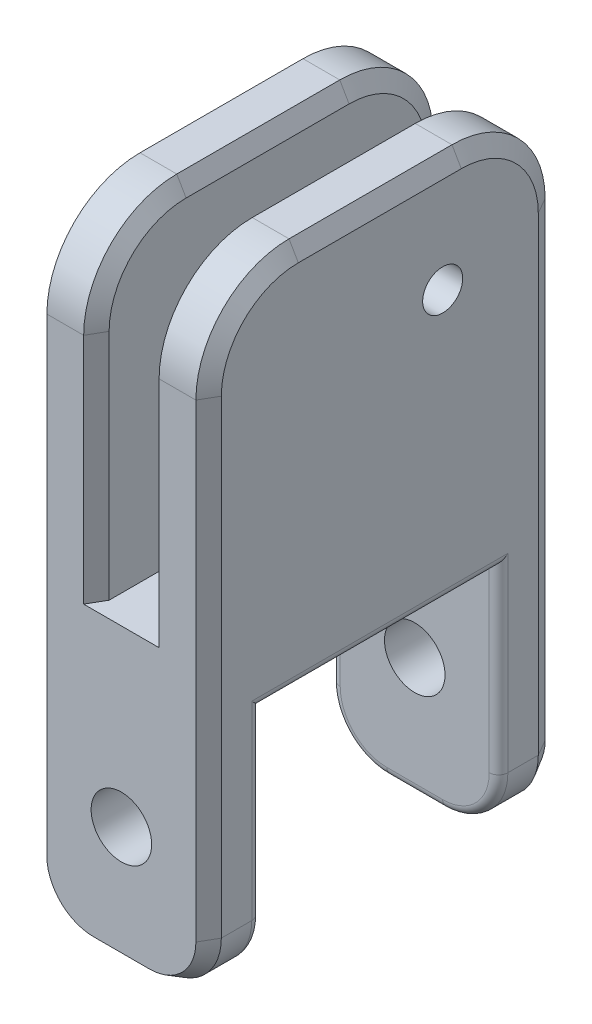
from build123d import *
from OCP.BRepFilletAPI import BRepFilletAPI_MakeChamfer

# Parameters (mm, degrees)
SKETCH1_W           = 18
SKETCH1_H           = 25.4
SKETCH1_R           = 3.25
BOSS_EXTRUDE1_DEPTH = 6
SKETCH2_W           = 18
SKETCH2_H           = 37.5
BOSS_EXTRUDE2_DEPTH = 6
SKETCH3_W           = 5.95
SKETCH3_H           = 37.5
BOSS_EXTRUDE3_DEPTH = 35
SKETCH4_R           = 2.15
CUT_EXTRUDE1_DEPTH  = 65.806944072
CUT_EXTRUDE2_REACH  = 66.807
SKETCH5_R           = 2.95
FILLET1_R           = 10
FILLET2_R           = 6
CHAMFER1_SIZE       = 1
CHAMFER1_SIZE2      = 1.732050808
CHAMFER2_SIZE       = 1
CHAMFER2_SIZE2      = 1.732050808
FILLET3_R           = 1


with BuildPart() as part:
    # Sketch1 → Boss-Extrude1 (new body)
    with BuildSketch(Plane.XY):
        Rectangle(SKETCH1_W, SKETCH1_H)
        Circle(SKETCH1_R, mode=Mode.SUBTRACT)
    boss_extrude1 = extrude(amount=BOSS_EXTRUDE1_DEPTH)

    # Sketch2 → Boss-Extrude2 (add)
    with BuildSketch(Plane(origin=(0, 12.7, 0), x_dir=(1, 0, 0), z_dir=(0, 1, 0))):
        with Locations((0, 12.75)):
            Rectangle(SKETCH2_W, SKETCH2_H)
    extrude(amount=BOSS_EXTRUDE2_DEPTH)

    # Mirror1: Boss-Extrude1 across plane
    add(boss_extrude1.mirror(Plane.XY.offset(-12.75)))

    # Sketch3 → Boss-Extrude3 (add)
    with BuildSketch(Plane(origin=(0, 18.7, 0), x_dir=(1, 0, 0), z_dir=(0, 1, 0))):
        with Locations((6.025, 12.75)):
            Rectangle(SKETCH3_W, SKETCH3_H)
    boss_extrude3 = extrude(amount=BOSS_EXTRUDE3_DEPTH)

    # Mirror2: Boss-Extrude3 across plane
    add(boss_extrude3.mirror(Plane(origin=(0, 0, 0), x_dir=(0, 0, 1), z_dir=(1, 0, 0))))

    # Sketch4 → Cut-Extrude1 (cut, through all)
    with BuildSketch(Plane(origin=(9, 0, 0), x_dir=(0, 0, -1), z_dir=(1, 0, 0))):
        with Locations((19.5, 41.7)):
            Circle(SKETCH4_R)
    extrude(amount=-CUT_EXTRUDE1_DEPTH, mode=Mode.SUBTRACT)

    # Sketch5 → Cut-Extrude2 (cut, up to next)
    with BuildSketch(Plane.ZY.offset(9), mode=Mode.PRIVATE) as cut_extrude2_sk1:
        with Locations((-19.5, 41.7)):
            Circle(SKETCH5_R)
    cut_extrude2_tool1 = extrude(cut_extrude2_sk1.sketch, amount=-CUT_EXTRUDE2_REACH, mode=Mode.PRIVATE) & part.part
    add(cut_extrude2_tool1.solids().sort_by_distance((-9, 41.7, -19.5))[0], mode=Mode.SUBTRACT)

    # Fillet1
    fillet1_edges = [part.edges().sort_by_distance(p)[0] for p in [
        (6.025, 53.7, -31.5),
        (6.025, 53.7, 6),
        (-6.025, 53.7, 6),
        (-6.025, 53.7, -31.5),
    ]]
    fillet(fillet1_edges, radius=FILLET1_R)

    # Fillet2
    fillet2_edges = [part.edges().sort_by_distance(p)[0] for p in [
        (9, -12.7, -28.5),
        (-9, -12.7, -28.5),
        (9, -12.7, 3),
        (-9, -12.7, 3),
    ]]
    fillet(fillet2_edges, radius=FILLET2_R)

    # Chamfer1: one chamfer whose edges measure the first distance from different faces: ONE call of the kernel's chamfer builder (chamfer() names one face for all edges)
    chamfer1_edges_1 = [part.edges().sort_by_distance(p)[0] for p in [
        (-3.05, 31.2, -31.5),
        (3.05, 31.2, -31.5),
    ]]
    chamfer1_side_1 = [part.faces().sort_by_distance(p)[0] for p in [
        (0, 13.700522402, -31.5),
    ]]
    chamfer1_edges_2 = [part.edges().sort_by_distance(p)[0] for p in [
        (-3.05, 53.7, -12.75),
    ]]
    chamfer1_side_2 = [part.faces().sort_by_distance(p)[0] for p in [
        (-6.025, 53.7, -12.75),
    ]]
    chamfer1_edges_3 = [part.edges().sort_by_distance(p)[0] for p in [
        (-3.05, 31.2, 6),
        (3.05, 31.2, 6),
    ]]
    chamfer1_side_3 = [part.faces().sort_by_distance(p)[0] for p in [
        (0, 13.700522402, 6),
    ]]
    chamfer1_edges_4 = [part.edges().sort_by_distance(p)[0] for p in [
        (-3.05, 50.771067812, 3.071067812),
    ]]
    chamfer1_side_4 = [part.faces().sort_by_distance(p)[0] for p in [
        (-6.025, 50.771067812, 3.071067812),
    ]]
    chamfer1_edges_5 = [part.edges().sort_by_distance(p)[0] for p in [
        (-3.05, 50.771067812, -28.571067812),
    ]]
    chamfer1_side_5 = [part.faces().sort_by_distance(p)[0] for p in [
        (-6.025, 50.771067812, -28.571067812),
    ]]
    chamfer1_edges_6 = [part.edges().sort_by_distance(p)[0] for p in [
        (3.05, 53.7, -12.75),
    ]]
    chamfer1_side_6 = [part.faces().sort_by_distance(p)[0] for p in [
        (6.025, 53.7, -12.75),
    ]]
    chamfer1_edges_7 = [part.edges().sort_by_distance(p)[0] for p in [
        (3.05, 50.771067812, 3.071067812),
    ]]
    chamfer1_side_7 = [part.faces().sort_by_distance(p)[0] for p in [
        (6.025, 50.771067812, 3.071067812),
    ]]
    chamfer1_edges_8 = [part.edges().sort_by_distance(p)[0] for p in [
        (3.05, 50.771067812, -28.571067812),
    ]]
    chamfer1_side_8 = [part.faces().sort_by_distance(p)[0] for p in [
        (6.025, 50.771067812, -28.571067812),
    ]]
    chamfer1 = BRepFilletAPI_MakeChamfer(part.part.solid().wrapped)
    for e in chamfer1_edges_1:
        chamfer1.Add(CHAMFER1_SIZE, CHAMFER1_SIZE2, e.wrapped, chamfer1_side_1[0].wrapped)  # the first distance lies on this face
    for e in chamfer1_edges_2:
        chamfer1.Add(CHAMFER1_SIZE, CHAMFER1_SIZE2, e.wrapped, chamfer1_side_2[0].wrapped)  # the first distance lies on this face
    for e in chamfer1_edges_3:
        chamfer1.Add(CHAMFER1_SIZE, CHAMFER1_SIZE2, e.wrapped, chamfer1_side_3[0].wrapped)  # the first distance lies on this face
    for e in chamfer1_edges_4:
        chamfer1.Add(CHAMFER1_SIZE, CHAMFER1_SIZE2, e.wrapped, chamfer1_side_4[0].wrapped)  # the first distance lies on this face
    for e in chamfer1_edges_5:
        chamfer1.Add(CHAMFER1_SIZE, CHAMFER1_SIZE2, e.wrapped, chamfer1_side_5[0].wrapped)  # the first distance lies on this face
    for e in chamfer1_edges_6:
        chamfer1.Add(CHAMFER1_SIZE, CHAMFER1_SIZE2, e.wrapped, chamfer1_side_6[0].wrapped)  # the first distance lies on this face
    for e in chamfer1_edges_7:
        chamfer1.Add(CHAMFER1_SIZE, CHAMFER1_SIZE2, e.wrapped, chamfer1_side_7[0].wrapped)  # the first distance lies on this face
    for e in chamfer1_edges_8:
        chamfer1.Add(CHAMFER1_SIZE, CHAMFER1_SIZE2, e.wrapped, chamfer1_side_8[0].wrapped)  # the first distance lies on this face
    add(Compound.cast(chamfer1.Shape()), mode=Mode.REPLACE)

    # Chamfer2: one chamfer whose edges measure the first distance from different faces: ONE call of the kernel's chamfer builder (chamfer() names one face for all edges)
    chamfer2_edges_1 = [part.edges().sort_by_distance(p)[0] for p in [
        (0, -12.7, -31.5),
        (7.242640687, -10.942640687, -31.5),
        (-7.242640687, -10.942640687, -31.5),
        (9, 18.5, -31.5),
        (-9, 18.5, -31.5),
    ]]
    chamfer2_side_1 = [part.faces().sort_by_distance(p)[0] for p in [
        (0, 12.555366953, -31.5),
    ]]
    chamfer2_edges_2 = [part.edges().sort_by_distance(p)[0] for p in [
        (9, 18.5, 6),
        (0, -12.7, 6),
        (7.242640687, -10.942640687, 6),
        (-7.242640687, -10.942640687, 6),
        (-9, 18.5, 6),
    ]]
    chamfer2_side_2 = [part.faces().sort_by_distance(p)[0] for p in [
        (0, 12.555366953, 6),
    ]]
    chamfer2_edges_3 = [part.edges().sort_by_distance(p)[0] for p in [
        (-9, 53.7, -12.75),
    ]]
    chamfer2_side_3 = [part.faces().sort_by_distance(p)[0] for p in [
        (-6.525, 53.7, -12.75),
    ]]
    chamfer2_edges_4 = [part.edges().sort_by_distance(p)[0] for p in [
        (-9, 50.771067812, 3.071067812),
    ]]
    chamfer2_side_4 = [part.faces().sort_by_distance(p)[0] for p in [
        (-6.525, 50.771067812, 3.071067812),
    ]]
    chamfer2_edges_5 = [part.edges().sort_by_distance(p)[0] for p in [
        (-9, 50.771067812, -28.571067812),
    ]]
    chamfer2_side_5 = [part.faces().sort_by_distance(p)[0] for p in [
        (-6.525, 50.771067812, -28.571067812),
    ]]
    chamfer2_edges_6 = [part.edges().sort_by_distance(p)[0] for p in [
        (9, 53.7, -12.75),
    ]]
    chamfer2_side_6 = [part.faces().sort_by_distance(p)[0] for p in [
        (6.525, 53.7, -12.75),
    ]]
    chamfer2_edges_7 = [part.edges().sort_by_distance(p)[0] for p in [
        (9, 50.771067812, 3.071067812),
    ]]
    chamfer2_side_7 = [part.faces().sort_by_distance(p)[0] for p in [
        (6.525, 50.771067812, 3.071067812),
    ]]
    chamfer2_edges_8 = [part.edges().sort_by_distance(p)[0] for p in [
        (9, 50.771067812, -28.571067812),
    ]]
    chamfer2_side_8 = [part.faces().sort_by_distance(p)[0] for p in [
        (6.525, 50.771067812, -28.571067812),
    ]]
    chamfer2 = BRepFilletAPI_MakeChamfer(part.part.solid().wrapped)
    for e in chamfer2_edges_1:
        chamfer2.Add(CHAMFER2_SIZE, CHAMFER2_SIZE2, e.wrapped, chamfer2_side_1[0].wrapped)  # the first distance lies on this face
    for e in chamfer2_edges_2:
        chamfer2.Add(CHAMFER2_SIZE, CHAMFER2_SIZE2, e.wrapped, chamfer2_side_2[0].wrapped)  # the first distance lies on this face
    for e in chamfer2_edges_3:
        chamfer2.Add(CHAMFER2_SIZE, CHAMFER2_SIZE2, e.wrapped, chamfer2_side_3[0].wrapped)  # the first distance lies on this face
    for e in chamfer2_edges_4:
        chamfer2.Add(CHAMFER2_SIZE, CHAMFER2_SIZE2, e.wrapped, chamfer2_side_4[0].wrapped)  # the first distance lies on this face
    for e in chamfer2_edges_5:
        chamfer2.Add(CHAMFER2_SIZE, CHAMFER2_SIZE2, e.wrapped, chamfer2_side_5[0].wrapped)  # the first distance lies on this face
    for e in chamfer2_edges_6:
        chamfer2.Add(CHAMFER2_SIZE, CHAMFER2_SIZE2, e.wrapped, chamfer2_side_6[0].wrapped)  # the first distance lies on this face
    for e in chamfer2_edges_7:
        chamfer2.Add(CHAMFER2_SIZE, CHAMFER2_SIZE2, e.wrapped, chamfer2_side_7[0].wrapped)  # the first distance lies on this face
    for e in chamfer2_edges_8:
        chamfer2.Add(CHAMFER2_SIZE, CHAMFER2_SIZE2, e.wrapped, chamfer2_side_8[0].wrapped)  # the first distance lies on this face
    add(Compound.cast(chamfer2.Shape()), mode=Mode.REPLACE)

    # Fillet3
    fillet3_edges = [part.edges().sort_by_distance(p)[0] for p in [
        (9, 3, -25.5),
        (0, -12.7, -25.5),
        (7.242640687, -10.942640687, -25.5),
        (-7.242640687, -10.942640687, -25.5),
        (9, 3, 0),
        (0, -12.7, 0),
        (7.242640687, -10.942640687, 0),
        (-7.242640687, -10.942640687, 0),
        (9, 12.7, -12.75),
        (-9, 12.7, -12.75),
        (-9, 3, -25.5),
        (-9, 3, 0),
    ]]
    fillet(fillet3_edges, radius=FILLET3_R)


solid = part.part
